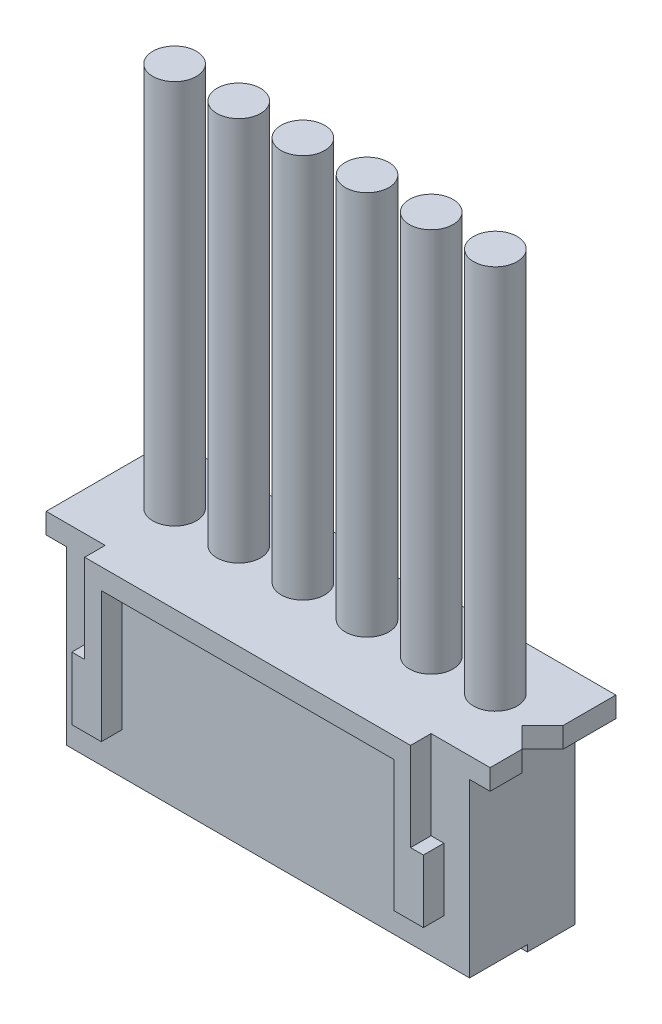
from build123d import *

# Parameters (mm, degrees)
ESQUISSE1_W                = 15.7
ESQUISSE1_H                = 4.1
BOSS_EXTRU_1_DEPTH         = 7.75
ESQUISSE2_W                = 15.7
ESQUISSE2_H                = 2.25
ENL_V_MAT_EXTRU_1_DEPTH    = 0.25
ESQUISSE3_W                = 17.3
ESQUISSE3_H                = 4.9
BOSS_EXTRU_2_DEPTH         = 0.8
ENL_V_MAT_EXTRU_4_DEPTH    = 12.95857433
BOSS_EXTRU_3_DEPTH         = 0.8
ENL_V_MAT_EXTRU_2_DEPTH    = 2.9
ESQUISSE6_W                = 0.75
ESQUISSE6_H                = 0.75
ENL_V_MAT_EXTRU_3_DEPTH    = 0.5
ESQUISSE7_R                = 0.85
BOSS_EXTRU_4_DEPTH         = 15
R_P_TITION_LIN_AIRE2_COUNT = 6
R_P_TITION_LIN_AIRE2_PITCH = 2.5


with BuildPart() as part:
    # Esquisse1 → Boss.-Extru.1 (new body)
    with BuildSketch(Plane(origin=(0, 0, 0), x_dir=(1, 0, 0), z_dir=(0, 1, 0))):
        Rectangle(ESQUISSE1_W, ESQUISSE1_H)
    extrude(amount=BOSS_EXTRU_1_DEPTH)

    # Esquisse2 → Enlèv. mat.-Extru.1 (cut)
    with BuildSketch(Plane(origin=(0, 0, 0), x_dir=(1, 0, 0), z_dir=(0, 1, 0))):
        with Locations((0, -0.925)):
            Rectangle(ESQUISSE2_W, ESQUISSE2_H)
    extrude(amount=ENL_V_MAT_EXTRU_1_DEPTH, mode=Mode.SUBTRACT)

    # Esquisse3 → Boss.-Extru.2 (add)
    with BuildSketch(Plane(origin=(0, 7.75, 0), x_dir=(1, 0, 0), z_dir=(0, 1, 0))):
        with Locations((0, 0.4)):
            Rectangle(ESQUISSE3_W, ESQUISSE3_H)
    extrude(amount=-BOSS_EXTRU_2_DEPTH)

    # Esquisse8 → Enlèv. mat.-Extru.4 (cut, through all)
    with BuildSketch(Plane(origin=(0, 7.75, 0), x_dir=(1, 0, 0), z_dir=(0, 1, 0))):
        Polygon((-0.8, 2.85), (0, 2.05), (0.8, 2.85), align=None)
        Polygon((8.65, 0.8), (7.85, 0), (8.65, -0.8), align=None)
    extrude(amount=-ENL_V_MAT_EXTRU_4_DEPTH, mode=Mode.SUBTRACT)

    # Esquisse4 → Boss.-Extru.3 (add)
    with BuildSketch(Plane.XY.offset(2.05)):
        Polygon((5.7, 6.95), (-5.7, 6.95), (-5.7, 1.85), (-6.85, 1.85), (-6.85, 4.3), (-6.35, 4.3), (-6.35, 7.75), (6.35, 7.75), (6.35, 4.3), (6.85, 4.3), (6.85, 1.85), (5.7, 1.85), align=None)
    extrude(amount=BOSS_EXTRU_3_DEPTH)

    # Esquisse5 → Enlèv. mat.-Extru.2 (cut)
    with BuildSketch(Plane(origin=(0, 0, 0), x_dir=(1, 0, 0), z_dir=(0, 1, 0))):
        Polygon((-6.915, 2.05), (-6.7, 1.25), (-5.8, 1.25), (-5.585, 2.05), align=None)
    enl_v_mat_extru_2 = extrude(amount=ENL_V_MAT_EXTRU_2_DEPTH, mode=Mode.SUBTRACT)

    # Esquisse6 → Enlèv. mat.-Extru.3 (cut)
    with BuildSketch(Plane.XZ.offset(-0.25)):
        with Locations((-6.25, 0.545)):
            Rectangle(ESQUISSE6_W, ESQUISSE6_H)
    enl_v_mat_extru_3 = extrude(amount=-ENL_V_MAT_EXTRU_3_DEPTH, mode=Mode.SUBTRACT)

    # Esquisse7 → Boss.-Extru.4 (add)
    with BuildSketch(Plane(origin=(0, 7.75, 0), x_dir=(1, 0, 0), z_dir=(0, 1, 0))):
        with Locations(Location((-6.25, 0.554746523, 0), (0, 0, 270))):
            Circle(ESQUISSE7_R)
    boss_extru_4 = extrude(amount=BOSS_EXTRU_4_DEPTH)

    # Répétition linéaire2: Enlèv. mat.-Extru.2, Enlèv. mat.-Extru.3, Boss.-Extru.4 ×6
    with Locations(*[(i * R_P_TITION_LIN_AIRE2_PITCH, 0, 0) for i in range(1, R_P_TITION_LIN_AIRE2_COUNT)]):
        add(enl_v_mat_extru_2, mode=Mode.SUBTRACT)
        add(enl_v_mat_extru_3, mode=Mode.SUBTRACT)
        add(boss_extru_4)


solid = part.part
